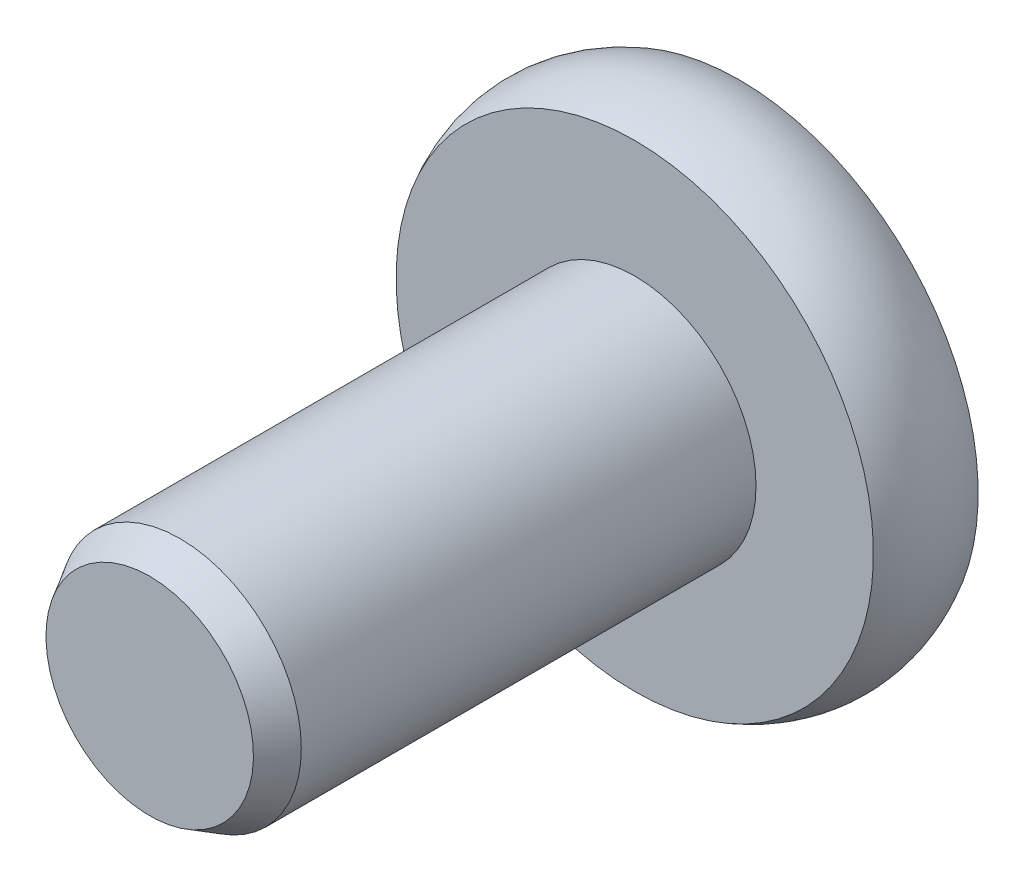
from build123d import *

# Parameters (mm, degrees)
CHAMFER1_SIZE  = 0.396875
CHAMFER1_SIZE2 = 0.229135888


with BuildPart() as part:
    # Sketch2 → Revolve1 (revolve)
    with BuildSketch(Plane(origin=(0, 0, 0), x_dir=(0, 0, -1), z_dir=(1, 0, 0)), mode=Mode.PRIVATE) as revolve1_sk:
        with BuildLine():
            Line((2.4892, 1.5875), (-3.8608, 1.5875))
            Line((-3.8608, 1.5875), (-3.8608, 0))
            Line((-3.8608, 0), (3.8608, 0))
            Line((3.8608, 0), (3.8608, 3.1242))
            ThreePointArc((3.8608, 3.1242), (3.175, 3.302), (2.4892, 3.1242))
            Line((2.4892, 3.1242), (2.4892, 1.5875))
        make_face()
    revolve(revolve1_sk.sketch.rotate(Axis((0, 0, 3.8608), (0, 0, -1)), 180), axis=Axis((0, 0, 3.8608), (0, 0, -1)))

    # Chamfer1
    chamfer1_edges = [part.edges().sort_by_distance(p)[0] for p in [
        (0, 1.5875, 3.8608),
    ]]
    chamfer1_side = [part.faces().sort_by_distance(p)[0] for p in [
        (0, 1.5875, 0.6858),
    ]]
    chamfer(chamfer1_edges, length=CHAMFER1_SIZE, length2=CHAMFER1_SIZE2, reference=chamfer1_side[0])


solid = part.part
